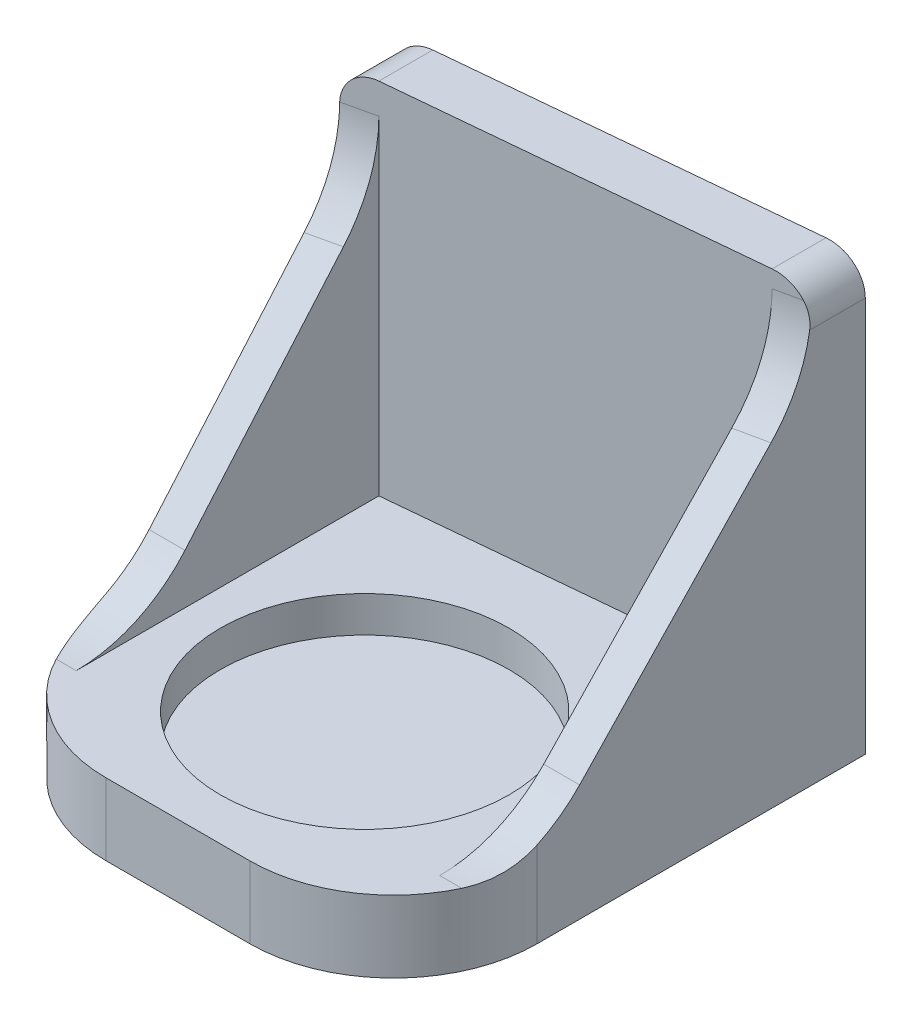
from build123d import *

# Parameters (mm, degrees)
BOSS_EXTRUDE1_DEPTH = 6.35
SKETCH2_R           = 12.7635
CUT_EXTRUDE1_DEPTH  = 3.175
BOSS_EXTRUDE2_DEPTH = 31.75
FILLET1_R           = 12.7
BOSS_EXTRUDE3_DEPTH = 3.175
BOSS_EXTRUDE7_DEPTH = 3.175
FILLET2_R           = 12.7
FILLET3_R           = 3.175


with BuildPart() as part:
    # Sketch1 → Boss-Extrude1 (new body)
    with BuildSketch(Plane(origin=(0, 0, 0), x_dir=(1, 0, 0), z_dir=(0, 1, 0))):
        Polygon((-19.05, 19.05), (-19.05, -19.05), (19.05, -19.05), (19.05, 22.651510368), align=None)
    extrude(amount=BOSS_EXTRUDE1_DEPTH)

    # Sketch2 → Cut-Extrude1 (cut)
    with BuildSketch(Plane(origin=(0, 6.35, 0), x_dir=(1, 0, 0), z_dir=(0, 1, 0))):
        with Locations(Location((0, -2.54, 0), (0, 0, 270))):
            Circle(SKETCH2_R)
    extrude(amount=-CUT_EXTRUDE1_DEPTH, mode=Mode.SUBTRACT)

    # Sketch3 → Boss-Extrude2 (add)
    with BuildSketch(Plane(origin=(0, 6.35, 0), x_dir=(1, 0, 0), z_dir=(0, 1, 0))):
        Polygon((19.05, 22.651510368), (-19.05, 19.05), (-19.05, 14.2875), (19.05, 17.889010368), align=None)
    extrude(amount=BOSS_EXTRUDE2_DEPTH)

    # Fillet1
    fillet1_edges = [part.edges().sort_by_distance(p)[0] for p in [
        (19.05, 3.175, 19.05),
        (-19.05, 3.175, 19.05),
    ]]
    fillet(fillet1_edges, radius=FILLET1_R)

    # Sketch4 → Boss-Extrude3 (add)
    with BuildSketch(Plane(origin=(19.05, 0, 0), x_dir=(0, 0, -1), z_dir=(1, 0, 0))):
        Polygon((-6.35, 6.35), (17.889010368, 31.75), (17.889010368, 6.35), align=None)
    extrude(amount=-BOSS_EXTRUDE3_DEPTH)

    # Sketch6 → Boss-Extrude7 (add)
    with BuildSketch(Plane.ZY.offset(19.05)):
        Polygon((-15.5575, 31.75), (6.35, 6.35), (-15.5575, 6.35), align=None)
    extrude(amount=-BOSS_EXTRUDE7_DEPTH)

    # Fillet2
    fillet2_edges = [part.edges().sort_by_distance(p)[0] for p in [
        (17.4625, 6.35, 6.35),
        (17.4625, 31.592749419, -17.738947436),
        (-17.4625, 6.35, 6.35),
        (-17.4625, 30.45152224, -14.437562932),
    ]]
    fillet(fillet2_edges, radius=FILLET2_R)

    # Fillet3
    fillet3_edges = [part.edges().sort_by_distance(p)[0] for p in [
        (19.05, 38.1, -20.270260368),
        (-19.05, 38.1, -16.66875),
    ]]
    fillet(fillet3_edges, radius=FILLET3_R)


solid = part.part
